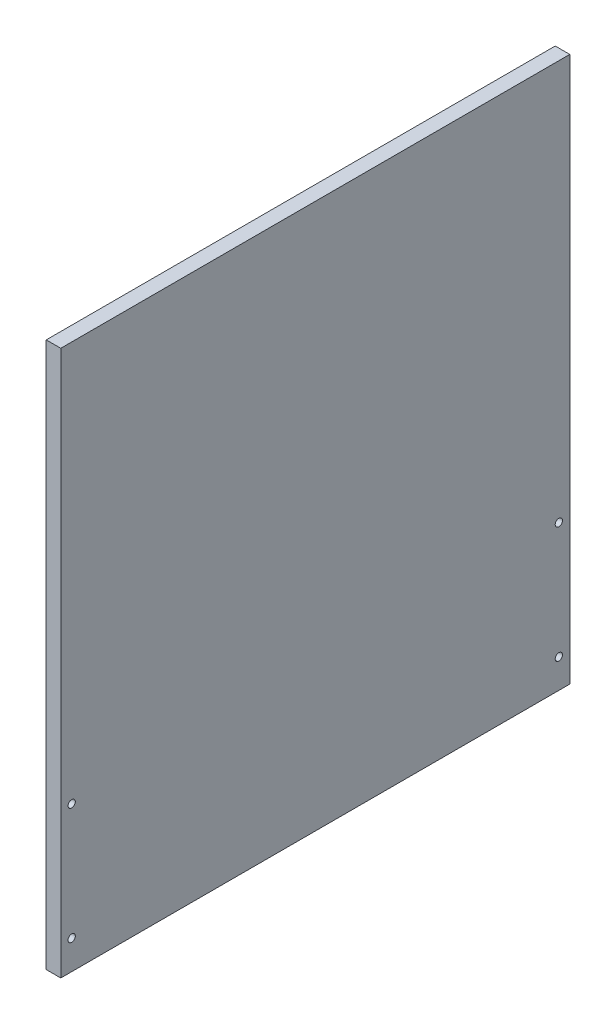
from build123d import *

# Parameters (mm, degrees)
SKETCH1_W           = 280
SKETCH1_H           = 300
BOSS_EXTRUDE1_DEPTH = 8
SKETCH2_R           = 2
CUT_EXTRUDE1_DEPTH  = 206.338744517


with BuildPart() as part:
    # Sketch1 → Boss-Extrude1 (new body)
    with BuildSketch(Plane(origin=(0, 0, 0), x_dir=(0, 0, -1), z_dir=(1, 0, 0))):
        Rectangle(SKETCH1_W, SKETCH1_H)
    extrude(amount=BOSS_EXTRUDE1_DEPTH)

    # Sketch2 → Cut-Extrude1 (cut, through all)
    with BuildSketch(Plane(origin=(0, 0, 0), x_dir=(0, 0, -1), z_dir=(1, 0, 0))):
        with Locations((134, -134)):
            Circle(SKETCH2_R)
        with Locations((134, -70)):
            Circle(SKETCH2_R)
    cut_extrude1 = extrude(amount=CUT_EXTRUDE1_DEPTH, mode=Mode.SUBTRACT)

    # Mirror1: Cut-Extrude1 across plane
    add(cut_extrude1.mirror(Plane.XY), mode=Mode.SUBTRACT)


solid = part.part
